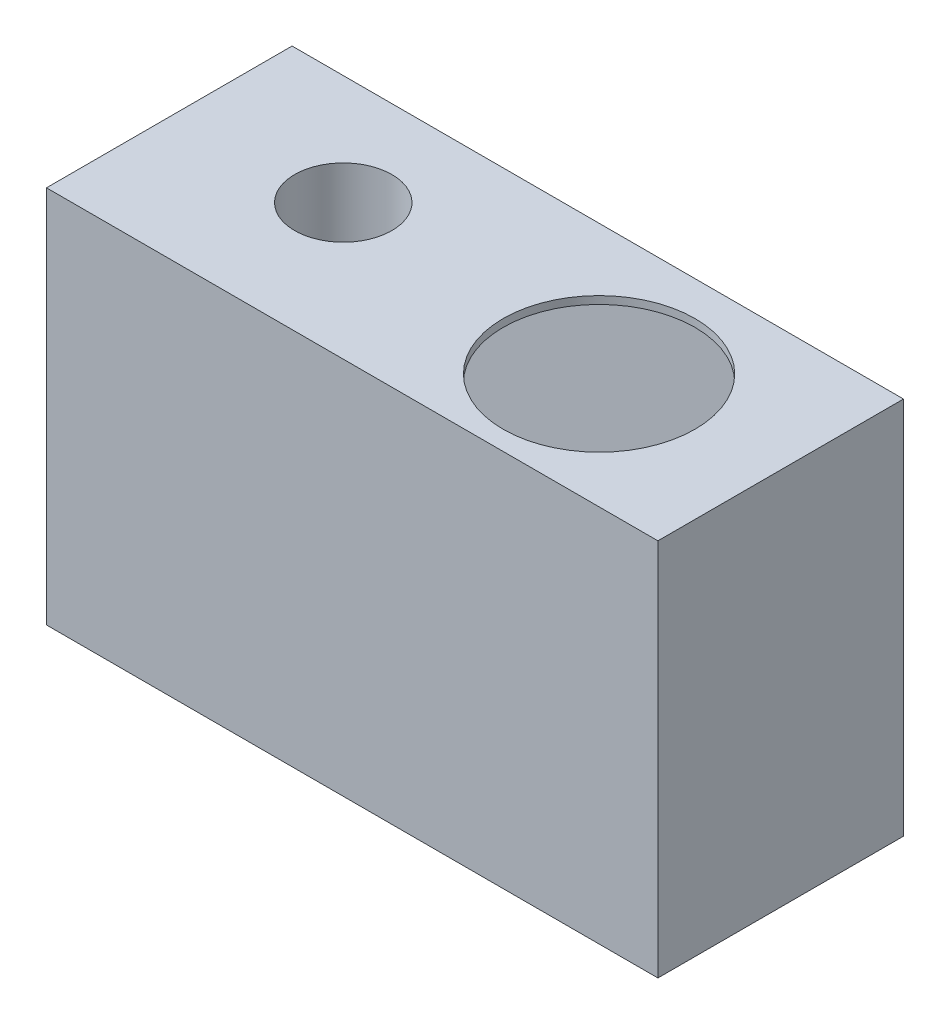
from build123d import *

# Parameters (mm, degrees)
SKETCH1_W           = 239
SKETCH1_H           = 96
BOSS_EXTRUDE1_DEPTH = 3
SKETCH2_W           = 239
SKETCH2_H           = 96
SKETCH2_W_2         = 233
SKETCH2_H_2         = 90
BOSS_EXTRUDE2_DEPTH = 145
SKETCH3_R           = 37.5
CUT_EXTRUDE1_DEPTH  = 3
SKETCH4_R           = 19
CUT_EXTRUDE2_DEPTH  = 3
BOSS_EXTRUDE3_START = 53
SKETCH5_R           = 22
SKETCH5_R_2         = 19
BOSS_EXTRUDE3_DEPTH = 53


with BuildPart() as part:
    # Sketch1 → Boss-Extrude1 (new body)
    with BuildSketch(Plane(origin=(0, 0, 0), x_dir=(1, 0, 0), z_dir=(0, 1, 0))):
        with Locations((119.5, -48)):
            Rectangle(SKETCH1_W, SKETCH1_H)
    extrude(amount=BOSS_EXTRUDE1_DEPTH)

    # Sketch2 → Boss-Extrude2 (add)
    with BuildSketch(Plane(origin=(0, 0, 0), x_dir=(-1, 0, 0), z_dir=(0, -1, 0))):
        with Locations((-119.5, -48)):
            Rectangle(SKETCH2_W, SKETCH2_H)
        with Locations((-119.5, -48)):
            Rectangle(SKETCH2_W_2, SKETCH2_H_2, mode=Mode.SUBTRACT)
    extrude(amount=BOSS_EXTRUDE2_DEPTH)

    # Sketch3 → Cut-Extrude1 (cut)
    with BuildSketch(Plane(origin=(0, 0, 0), x_dir=(-1, 0, 0), z_dir=(0, -1, 0))):
        with Locations(Location((-171, -51, 0), (0, 0, 90))):
            Circle(SKETCH3_R)
    extrude(amount=-CUT_EXTRUDE1_DEPTH, mode=Mode.SUBTRACT)

    # Sketch4 → Cut-Extrude2 (cut)
    with BuildSketch(Plane(origin=(0, 0, 0), x_dir=(-1, 0, 0), z_dir=(0, -1, 0))):
        with Locations(Location((-63, -43, 0), (0, 0, 90))):
            Circle(SKETCH4_R)
    extrude(amount=-CUT_EXTRUDE2_DEPTH, mode=Mode.SUBTRACT)

    # Sketch5 → Boss-Extrude3 (add)
    with BuildSketch(Plane(origin=(0, 0, 0), x_dir=(-1, 0, 0), z_dir=(0, -1, 0)).offset(BOSS_EXTRUDE3_START)):
        with Locations(Location((-63, -43, 0), (0, 0, 270))):
            Circle(SKETCH5_R)
        with Locations(Location((-63, -43, 0), (0, 0, 90))):
            Circle(SKETCH5_R_2, mode=Mode.SUBTRACT)
    extrude(amount=-BOSS_EXTRUDE3_DEPTH)


solid = part.part
